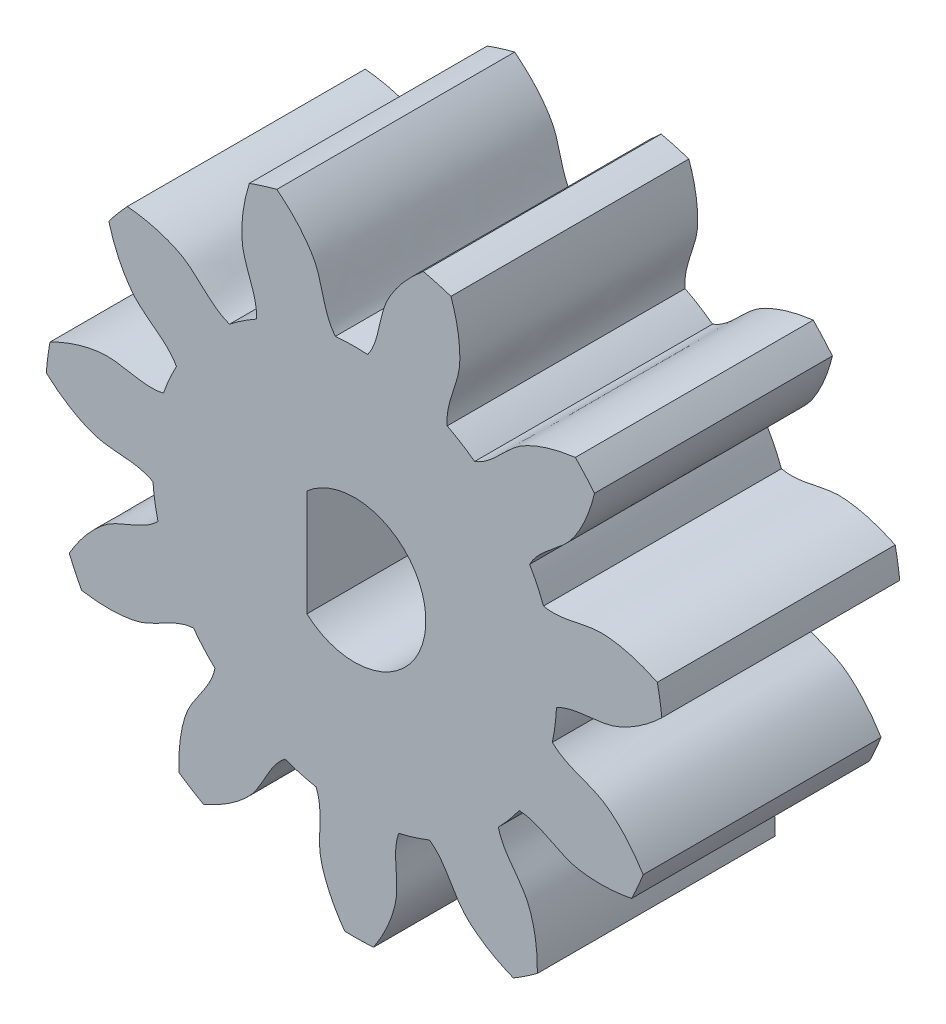
from build123d import *

# Parameters (mm, degrees)
SKETCH_1_R               = 4.25
EXTRUDE_1_DEPTH          = 5
EXTRUDE_2_DEPTH          = 5
PATTERN_CIRCULAR_1_COUNT = 11


with BuildPart() as part:
    # 草图1 → 凸台-拉伸1 (new body)
    with BuildSketch(Plane.XY):
        Circle(SKETCH_1_R)
        with BuildLine():
            Line((-1, 1.118033989), (-1, -1.118033989))
            ThreePointArc((-1, -1.118033989), (1.5, 0), (-1, 1.118033989))
        make_face(mode=Mode.SUBTRACT)
    extrude(amount=EXTRUDE_1_DEPTH)

    # 草图2 → 凸台-拉伸2 (add)
    with BuildSketch(Plane.XY):
        with BuildLine():
            ThreePointArc((6.364840058, 1.318639842), (6.41933804, 1.020832567), (6.459909598, 0.720810648))
            add(Edge.make_bspline(
                [(6.459909598, 0.720810648), (6.30503635, 0.573432081), (6.060220687, 0.372889718), (5.705124958, 0.167850699), (5.152234448, -0.07959703), (4.606066867, 0.004749759), (4.245132436, -0.203348467)],
                knots=[0, 0, 0, 0, 0.262447939, 0.385242457, 0.502396504, 1, 1, 1, 1], degree=3))
            ThreePointArc((4.245132436, -0.203348467), (4.197259488, 0.667467448), (3.972639872, 1.510176297))
            add(Edge.make_bspline(
                [(6.364840058, 1.318639842), (6.171889239, 1.410705831), (5.87694123, 1.5254125), (5.475758403, 1.610184636), (4.873382667, 1.67391663), (4.380322357, 1.424307057), (3.972639872, 1.510176297)],
                knots=[0, 0, 0, 0, 0.262447939, 0.385242457, 0.502396504, 1, 1, 1, 1], degree=3))
        make_face()
    extrude_2 = extrude(amount=EXTRUDE_2_DEPTH)

    # 阵列(圆周)1: 凸台-拉伸2 ×11 about axis
    pattern_circular_1_axis = Axis((0, 0, 5), (0, 0, -1))
    for i in range(1, PATTERN_CIRCULAR_1_COUNT):
        add(extrude_2.rotate(pattern_circular_1_axis, i * 360 / PATTERN_CIRCULAR_1_COUNT))


solid = part.part
